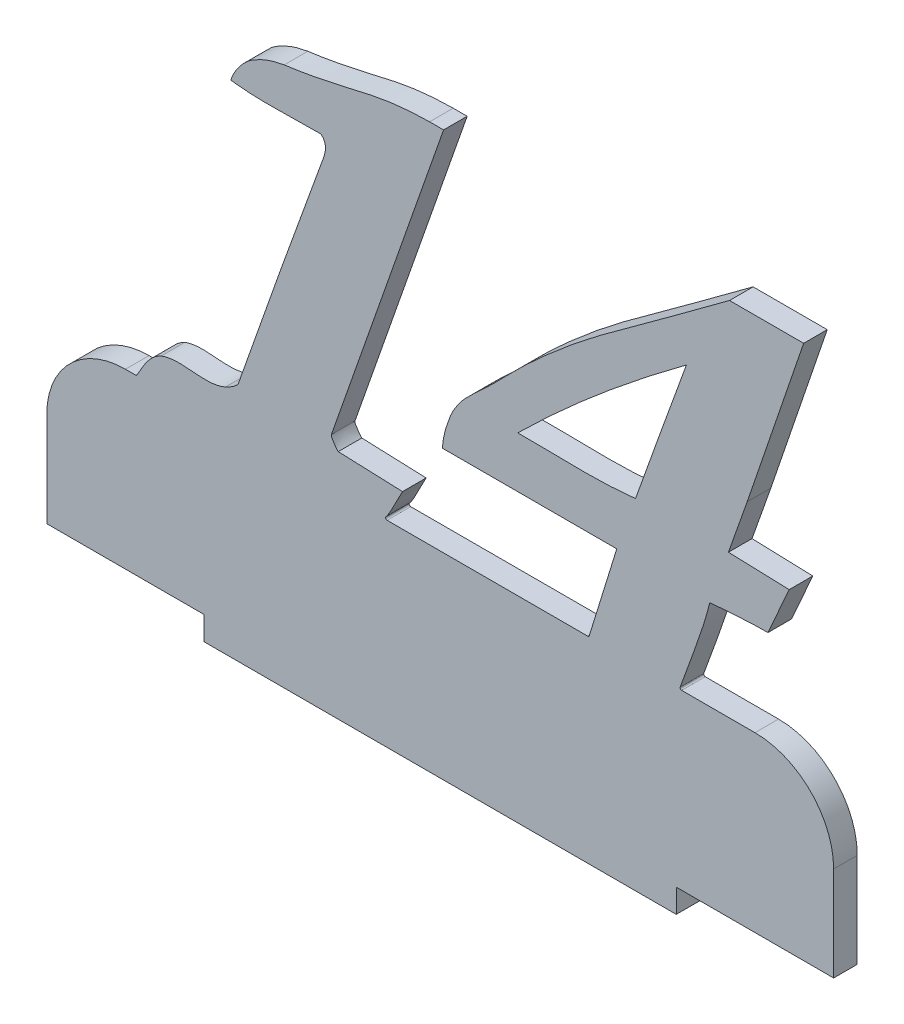
from build123d import *

# Parameters (mm, degrees)
BOSS_EXTRUDE1_DEPTH = 3
FILLET1_R           = 10
FILLET2_R           = 0.2


with BuildPart() as part:
    # Sketch1 → Boss-Extrude1 (new body)
    with BuildSketch(Plane.XY):
        with BuildLine():
            Line((42.749612228, 22.000000982), (68.900263663, 22.000000982))
            Line((68.900263663, 22.000000982), (72.438655427, 33.449873816))
            Line((72.438655427, 33.449873816), (50.272900931, 33.449873816))
            add(Edge.make_bspline(
                [(50.272900931, 33.449873816), (50.399701069, 35.232060422), (51.07430828, 36.890061462)],
                knots=[0, 0, 0, 1, 1, 1], degree=2))
            add(Edge.make_bspline(
                [(51.07430828, 36.890061462), (51.325314504, 37.69426052), (51.918420301, 38.823627057), (52.965393254, 40.197356727), (55.040325227, 42.226401797), (56.906069545, 43.842187727), (58.267427905, 45.334158413)],
                knots=[0, 0, 0, 0, 0.224443411, 0.338858347, 0.460950835, 1, 1, 1, 1], degree=3))
            add(Edge.make_bspline(
                [(58.267427905, 45.334158413), (60.384790067, 47.521422491), (63.79764632, 50.686490857), (68.693222774, 54.688016487), (72.643154035, 57.622122808), (76.561208747, 60.443533866), (81.264828304, 63.875801937), (84.634451747, 66.35024823), (86.766255114, 67.949482885)],
                knots=[0, 0, 0, 0, 0.250612348, 0.382931529, 0.520503025, 0.655730691, 0.780544062, 1, 1, 1, 1], degree=3))
            Line((86.766255114, 67.949482885), (96.1876781, 67.949482885))
            Line((96.1876781, 67.949482885), (89.014104997, 46.917426591))
            Line((89.014104997, 46.917426591), (86.629429469, 40.173876943))
            Line((86.629429469, 40.173876943), (94.350305153, 39.919772174))
            Line((94.350305153, 39.919772174), (91.652885294, 33.84080423))
            add(Edge.make_bspline(
                [(91.652885294, 33.84080423), (90.615751555, 33.849650126), (88.151293743, 33.72895626), (85.689091845, 33.579119519), (84.264300462, 33.449873816)],
                knots=[0, 0, 0, 0, 0.420206299, 1, 1, 1, 1], degree=3))
            add(Edge.make_bspline(
                [(84.264300462, 33.449873816), (83.751919692, 31.362918248), (82.707539096, 28.321707646), (81.319432158, 24.539092544), (80.676394779, 22.768772837), (80.402865584, 22.000000982)],
                knots=[0, 0, 0, 0, 0.502209297, 0.752080888, 0.943038063, 0.943038063, 0.943038063, 0.943038063], degree=3))
            Line((80.402865584, 22.000000982), (90.110220598, 22.000000982))
            Line((90.110220598, 22.000000982), (100, 22.000000982))
            Line((100, 22.000000982), (100, 0))
            Line((100, 0), (80, 0))
            Line((80, 0), (80, -3))
            Line((80, -3), (20, -3))
            Line((20, -3), (20, 0))
            Line((20, 0), (0, 0))
            Line((0, 0), (0, 22.000000982))
            Line((0, 22.000000982), (11.406772984, 22.000000982))
            add(Edge.make_bspline(
                [(11.406772984, 22.000000982), (11.481923411, 22.128324781), (11.803942066, 22.690265443), (12.606466874, 24.1299098), (13.601086209, 25.299520611), (14.541861056, 25.728998132)],
                knots=[0.174411648, 0.174411648, 0.174411648, 0.174411648, 0.24891213, 0.498932816, 1, 1, 1, 1], degree=3))
            add(Edge.make_bspline(
                [(14.541861056, 25.728998132), (15.88322935, 26.248262142), (18.633967114, 25.973494082), (21.403300538, 25.817845983), (22.712306717, 26.393579836)],
                knots=[0, 0, 0, 0, 0.501451854, 1, 1, 1, 1], degree=3))
            add(Edge.make_bspline(
                [(22.712306717, 26.393579836), (23.593849654, 26.784092389), (24.295574895, 27.449091955)],
                knots=[0, 0, 0, 1, 1, 1], degree=2))
            add(Edge.make_bspline(
                [(24.295574895, 27.449091955), (26.077870774, 32.484264955), (29.602867976, 42.60706621), (33.291895969, 52.671262962), (35.124347373, 57.726652549)],
                knots=[0, 0, 0, 0, 0.498322561, 1, 1, 1, 1], degree=3))
            add(Edge.make_bspline(
                [(35.124347373, 57.726652549), (35.307524439, 58.224190762), (35.602710566, 59.190766536), (35.150116794, 60.102162008), (34.792056521, 60.306793284)],
                knots=[0, 0, 0, 0, 0.581397084, 1, 1, 1, 1], degree=3))
            add(Edge.make_bspline(
                [(34.792056521, 60.306793284), (32.875335639, 60.340590356), (29.070344759, 60.156681953), (25.25736304, 60.26141883), (23.376888421, 60.502258491)],
                knots=[0, 0, 0, 0, 0.503014916, 1, 1, 1, 1], degree=3))
            add(Edge.make_bspline(
                [(23.376888421, 60.502258491), (23.608850931, 61.169430986), (24.093094541, 62.118385021), (25.011088656, 63.179121193), (25.784372398, 63.90164623), (26.73233409, 64.45535482), (28.159352101, 65.138054442), (29.35140978, 65.452871316), (30.179077631, 65.584353878)],
                knots=[0, 0, 0, 0, 0.237267367, 0.352023708, 0.469658656, 0.590380818, 0.718477308, 1, 1, 1, 1], degree=3))
            add(Edge.make_bspline(
                [(30.179077631, 65.584353878), (33.291343657, 65.982791022), (37.153111251, 66.834794979), (41.774910805, 67.914609184), (44.8548119, 68.397084929), (47.147903193, 68.544635368), (48.650539711, 68.555425028)],
                knots=[0, 0, 0, 0, 0.501477793, 0.632810111, 0.759518477, 1, 1, 1, 1], degree=3))
            add(Edge.make_bspline(
                [(48.650539711, 68.555425028), (48.859035932, 68.555425028), (49.451947061, 68.555425028), (50.044858189, 68.555425028), (50.429273097, 68.555425028)],
                knots=[0, 0, 0, 0, 0.351648352, 1, 1, 1, 1], degree=3))
            Line((50.429273097, 68.555425028), (36.179859492, 27.918208452))
            add(Edge.make_bspline(
                [(36.179859492, 27.918208452), (36.126676837, 27.718411957), (36.458316573, 27.208718898), (36.736006921, 26.725936024), (37.039906404, 26.452219398)],
                knots=[0, 0, 0, 0, 0.324502414, 1, 1, 1, 1], degree=3))
            Line((37.039906404, 26.452219398), (45.210352065, 26.139475067))
            add(Edge.make_bspline(
                [(45.210352065, 26.139475067), (44.6154125, 25.12625594), (44.070252391, 23.804016563), (43.219476455, 22.414888166), (42.889953696, 22.11142887), (42.749612228, 22.000000982)],
                knots=[0, 0, 0, 0, 0.504343167, 0.619768133, 0.696711259, 0.696711259, 0.696711259, 0.696711259], degree=3))
        make_face()
        with BuildLine():
            add(Edge.make_bspline(
                [(81.293229312, 58.117582963), (77.336378308, 55.190834109), (69.966290168, 49.375200463), (63.02434641, 43.054636478), (59.850696083, 39.919772174)],
                knots=[0, 0, 0, 0, 0.524587428, 1, 1, 1, 1], degree=3))
            add(Edge.make_bspline(
                [(59.850696083, 39.919772174), (62.347046703, 39.956138517), (67.338663055, 39.755607803), (72.337038175, 39.898913575), (74.823330954, 40.173876943)],
                knots=[0, 0, 0, 0, 0.499665743, 1, 1, 1, 1], degree=3))
            add(Edge.make_bspline(
                [(74.823330954, 40.173876943), (75.929225459, 43.166496772), (78.017470904, 49.172207513), (80.19988778, 55.144320848), (81.293229312, 58.117582963)],
                knots=[0, 0, 0, 0, 0.501754487, 1, 1, 1, 1], degree=3))
        make_face(mode=Mode.SUBTRACT)
    extrude(amount=BOSS_EXTRUDE1_DEPTH)

    # Fillet1
    fillet1_edges = [part.edges().sort_by_distance(p)[0] for p in [
        (100, 22.000000982, 1.5),
        (0, 22.000000982, 1.5),
    ]]
    fillet(fillet1_edges, radius=FILLET1_R)

    # Fillet2
    fillet2_edges = [part.edges().sort_by_distance(p)[0] for p in [
        (80.402865584, 22.000000982, 1.5),
        (42.749612228, 22.000000982, 1.5),
        (68.900263663, 22.000000982, 1.5),
        (11.406772984, 22.000000982, 1.5),
    ]]
    fillet(fillet2_edges, radius=FILLET2_R)


solid = part.part
